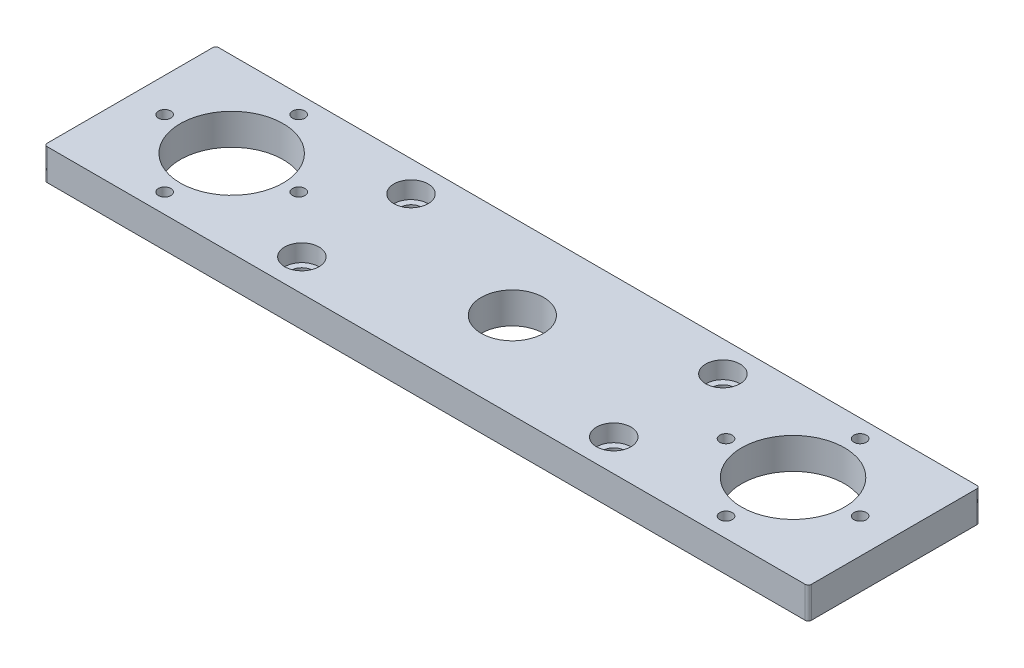
from build123d import *

# Parameters (mm, degrees)
SKETCH_1_W          = 245
SKETCH_1_H          = 55
SKETCH_1_R          = 16.5
SKETCH_1_R_2        = 2
SKETCH_1_R_3        = 3.5
SKETCH_1_R_4        = 10
EXTRUDE_4_DEPTH     = 10
SKETCH_2_R          = 5.5
CUT_EXTRUDE_1_DEPTH = 5.5
FILLET_1_R          = 1


with BuildPart() as part:
    # 草图1 → 凸台-拉伸4 (new body)
    with BuildSketch(Plane(origin=(0, 0, 0), x_dir=(1, 0, 0), z_dir=(0, 1, 0))):
        with Locations((122.617986059, 27.264027881)):
            Rectangle(SKETCH_1_W, SKETCH_1_H)
        with Locations(Location((32.5, 27.5, 0), (0, 0, 270))):
            Circle(SKETCH_1_R, mode=Mode.SUBTRACT)
        with Locations(Location((11, 27.5, 0), (0, 0, 270))):
            Circle(SKETCH_1_R_2, mode=Mode.SUBTRACT)
        with Locations(Location((54, 27.5, 0), (0, 0, 270))):
            Circle(SKETCH_1_R_2, mode=Mode.SUBTRACT)
        with Locations(Location((32.5, 6, 0), (0, 0, 270))):
            Circle(SKETCH_1_R_2, mode=Mode.SUBTRACT)
        with Locations(Location((72.5, 10, 0), (0, 0, 270))):
            Circle(SKETCH_1_R_3, mode=Mode.SUBTRACT)
        with Locations(Location((72.5, 45, 0), (0, 0, 270))):
            Circle(SKETCH_1_R_3, mode=Mode.SUBTRACT)
        with Locations(Location((32.5, 49, 0), (0, 0, 270))):
            Circle(SKETCH_1_R_2, mode=Mode.SUBTRACT)
        with Locations(Location((212.5, 6, 0), (0, 0, 270))):
            Circle(SKETCH_1_R_2, mode=Mode.SUBTRACT)
        with Locations(Location((172.5, 10, 0), (0, 0, 270))):
            Circle(SKETCH_1_R_3, mode=Mode.SUBTRACT)
        with Locations(Location((234, 27.5, 0), (0, 0, 270))):
            Circle(SKETCH_1_R_2, mode=Mode.SUBTRACT)
        with Locations(Location((191, 27.5, 0), (0, 0, 270))):
            Circle(SKETCH_1_R_2, mode=Mode.SUBTRACT)
        with Locations(Location((172.5, 45, 0), (0, 0, 270))):
            Circle(SKETCH_1_R_3, mode=Mode.SUBTRACT)
        with Locations(Location((212.5, 49, 0), (0, 0, 270))):
            Circle(SKETCH_1_R_2, mode=Mode.SUBTRACT)
        with Locations(Location((212.5, 27.5, 0), (0, 0, 270))):
            Circle(SKETCH_1_R, mode=Mode.SUBTRACT)
        with Locations(Location((122.5, 27.5, 0), (0, 0, 270))):
            Circle(SKETCH_1_R_4, mode=Mode.SUBTRACT)
    extrude(amount=EXTRUDE_4_DEPTH)

    # 草图2 → 切除-拉伸1 (cut)
    with BuildSketch(Plane(origin=(0, 10, 0), x_dir=(1, 0, 0), z_dir=(0, 1, 0))):
        with Locations(Location((72.5, 45, 0), (0, 0, 270))):
            Circle(SKETCH_2_R)
        with Locations(Location((72.5, 10, 0), (0, 0, 270))):
            Circle(SKETCH_2_R)
        with Locations(Location((172.5, 45, 0), (0, 0, 270))):
            Circle(SKETCH_2_R)
        with Locations(Location((172.5, 10, 0), (0, 0, 270))):
            Circle(SKETCH_2_R)
    extrude(amount=-CUT_EXTRUDE_1_DEPTH, mode=Mode.SUBTRACT)

    # 圆角1
    fillet_1_edges = [part.edges().sort_by_distance(p)[0] for p in [
        (0.117986059, 5, -54.764027881),
        (0.117986059, 5, 0.235972119),
        (245.117986059, 5, 0.235972119),
        (245.117986059, 5, -54.764027881),
    ]]
    fillet(fillet_1_edges, radius=FILLET_1_R)


solid = part.part
